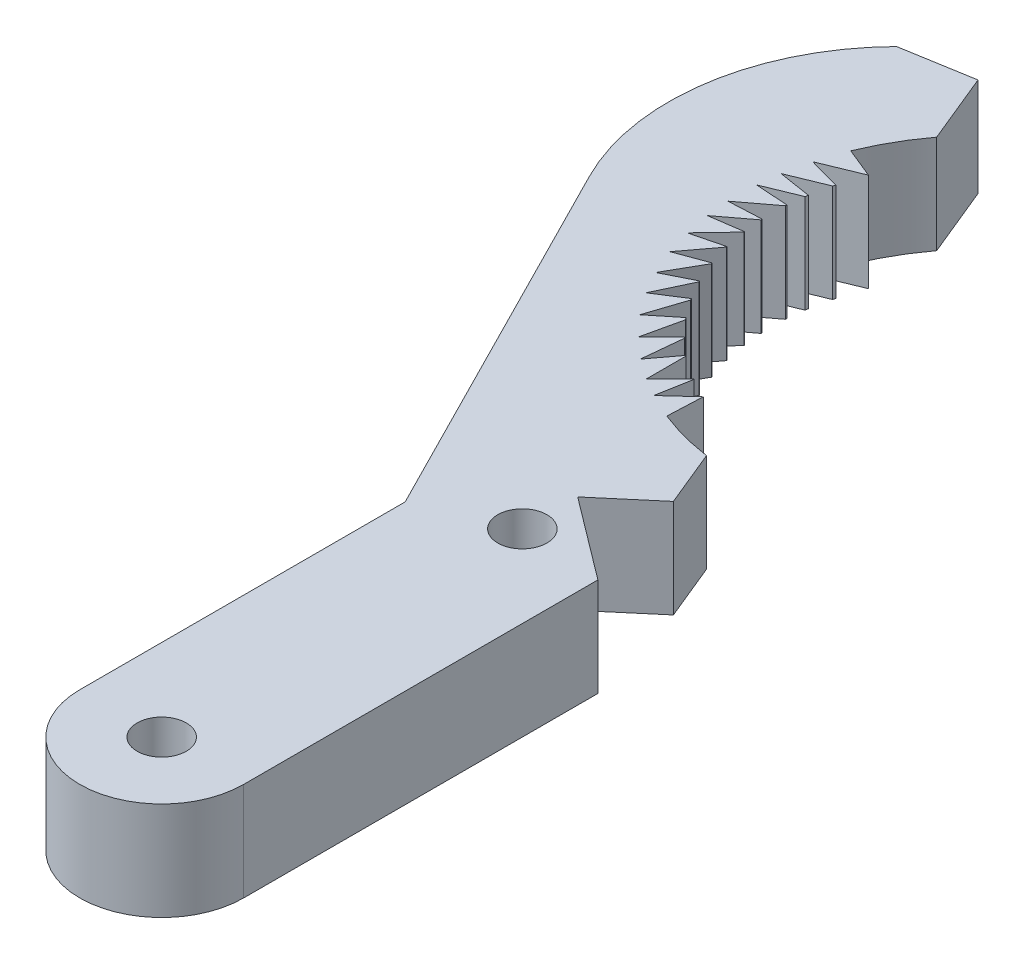
from build123d import *

# Parameters (mm, degrees)
SKETCH_1_R      = 1.5
EXTRUDE_1_DEPTH = 6


with BuildPart() as part:
    # 草图1 → 凸台-拉伸1 (new body)
    with BuildSketch(Plane(origin=(0, 0, 0), x_dir=(1, 0, 0), z_dir=(0, 1, 0))):
        with BuildLine():
            Line((-9.737949598, 0.947255951), (-9.737949598, -18.902744049))
            ThreePointArc((-9.737949598, -18.902744049), (-4.737949598, -23.902744049), (0.262050402, -18.902744049))
            Line((0.262050402, -18.902744049), (0.262050402, 2.705554152))
            Line((0.262050402, 2.705554152), (-4.737949598, 6.473971492))
            Line((-4.737949598, 6.473971492), (-1.581691427, 9.155643094))
            Line((-1.581691427, 9.155643094), (-2.990655676, 12.582531705))
            ThreePointArc((-2.990655676, 12.582531705), (-4.665394525, 12.928054539), (-6.289924982, 13.461943142))
            Line((-6.289924982, 13.461943142), (-6.197163572, 15.594373686))
            Line((-6.197163572, 15.594373686), (-7.779733646, 14.143748571))
            Line((-7.779733646, 14.143748571), (-7.398920758, 16.220154199))
            ThreePointArc((-7.398920758, 16.220154199), (-7.410512726, 16.226988873), (-7.422097613, 16.233835543))
            Line((-7.422097613, 16.233835543), (-8.875748064, 14.780185092))
            Line((-8.875748064, 14.780185092), (-8.875748064, 17.233009419))
            ThreePointArc((-8.875748064, 17.233009419), (-8.89176269, 17.245719789), (-8.907757306, 17.25845533))
            Line((-8.907757306, 17.25845533), (-10.109322939, 15.658717321))
            Line((-10.109322939, 15.658717321), (-9.864779998, 18.101747371))
            ThreePointArc((-9.864779998, 18.101747371), (-9.900992511, 18.13709659), (-9.937067144, 18.172586506))
            Line((-9.937067144, 18.172586506), (-11.342451387, 16.749598407))
            Line((-11.342451387, 16.749598407), (-10.808718868, 19.12339663))
            ThreePointArc((-10.808718868, 19.12339663), (-10.8603358, 19.186034382), (-10.91156065, 19.248993181))
            Line((-10.91156065, 19.248993181), (-12.466866971, 17.991606109))
            Line((-12.466866971, 17.991606109), (-11.694242841, 20.325491599))
            ThreePointArc((-11.694242841, 20.325491599), (-11.723768007, 20.371016087), (-11.753102902, 20.416663414))
            Line((-11.753102902, 20.416663414), (-13.437877261, 19.338917916))
            Line((-13.437877261, 19.338917916), (-12.397936945, 21.545287297))
            ThreePointArc((-12.397936945, 21.545287297), (-12.412363311, 21.573840278), (-12.426719371, 21.602428674))
            Line((-12.426719371, 21.602428674), (-14.215127033, 20.7071086))
            Line((-14.215127033, 20.7071086), (-12.980819551, 22.874696888))
            ThreePointArc((-12.980819551, 22.874696888), (-12.991659581, 22.903835263), (-13.002429896, 22.932999479))
            Line((-13.002429896, 22.932999479), (-14.879408408, 22.242382606))
            Line((-14.879408408, 22.242382606), (-13.399650606, 24.212499539))
            ThreePointArc((-13.399650606, 24.212499539), (-13.404668281, 24.232259063), (-13.409654964, 24.25202643))
            Line((-13.409654964, 24.25202643), (-15.349283486, 23.764336781))
            Line((-15.349283486, 23.764336781), (-13.663841103, 25.531286293))
            ThreePointArc((-13.663841103, 25.531286293), (-13.666952622, 25.552575019), (-13.670028903, 25.573868865))
            Line((-13.670028903, 25.573868865), (-15.649714954, 25.28953959))
            Line((-15.649714954, 25.28953959), (-13.782119424, 26.702074649))
            Line((-13.782119424, 26.702074649), (-13.786071717, 26.777270326))
            Line((-13.786071717, 26.777270326), (-15.783610509, 26.678079738))
            Line((-15.783610509, 26.678079738), (-13.779118172, 28.19415517))
            ThreePointArc((-13.779118172, 28.19415517), (-13.776521837, 28.236618422), (-13.773786555, 28.27907295))
            Line((-13.773786555, 28.27907295), (-15.769435323, 28.41092892))
            Line((-15.769435323, 28.41092892), (-13.669425272, 29.274347437))
            ThreePointArc((-13.669425272, 29.274347437), (-13.656782501, 29.360141075), (-13.643567704, 29.445848467))
            Line((-13.643567704, 29.445848467), (-15.619182802, 29.757208362))
            Line((-15.619182802, 29.757208362), (-13.388679068, 30.674279319))
            ThreePointArc((-13.388679068, 30.674279319), (-13.368727635, 30.750538102), (-13.348314176, 30.826674507))
            Line((-13.348314176, 30.826674507), (-15.278505654, 31.350469177))
            Line((-15.278505654, 31.350469177), (-12.868620153, 32.341292896))
            Line((-12.868620153, 32.341292896), (-14.692134653, 33.084702139))
            ThreePointArc((-14.692134653, 33.084702139), (-13.851601264, 34.818611239), (-12.795725249, 36.430462034))
            Line((-12.795725249, 36.430462034), (-14.555144967, 40.70972987))
            Line((-14.555144967, 40.70972987), (-18.80498844, 39.992143324))
            ThreePointArc((-18.80498844, 39.992143324), (-22.673158885, 32.282486217), (-21.315703366, 23.764336781))
            Line((-21.315703366, 23.764336781), (-9.737949598, 0.947255951))
        make_face()
        with Locations(Location((-4.737949598, -18.902744049, 0), (0, 0, 270))):
            Circle(SKETCH_1_R, mode=Mode.SUBTRACT)
        with Locations(Location((-4.737949598, 3.097255951, 0), (0, 0, 270))):
            Circle(SKETCH_1_R, mode=Mode.SUBTRACT)
    extrude(amount=EXTRUDE_1_DEPTH)


solid = part.part
